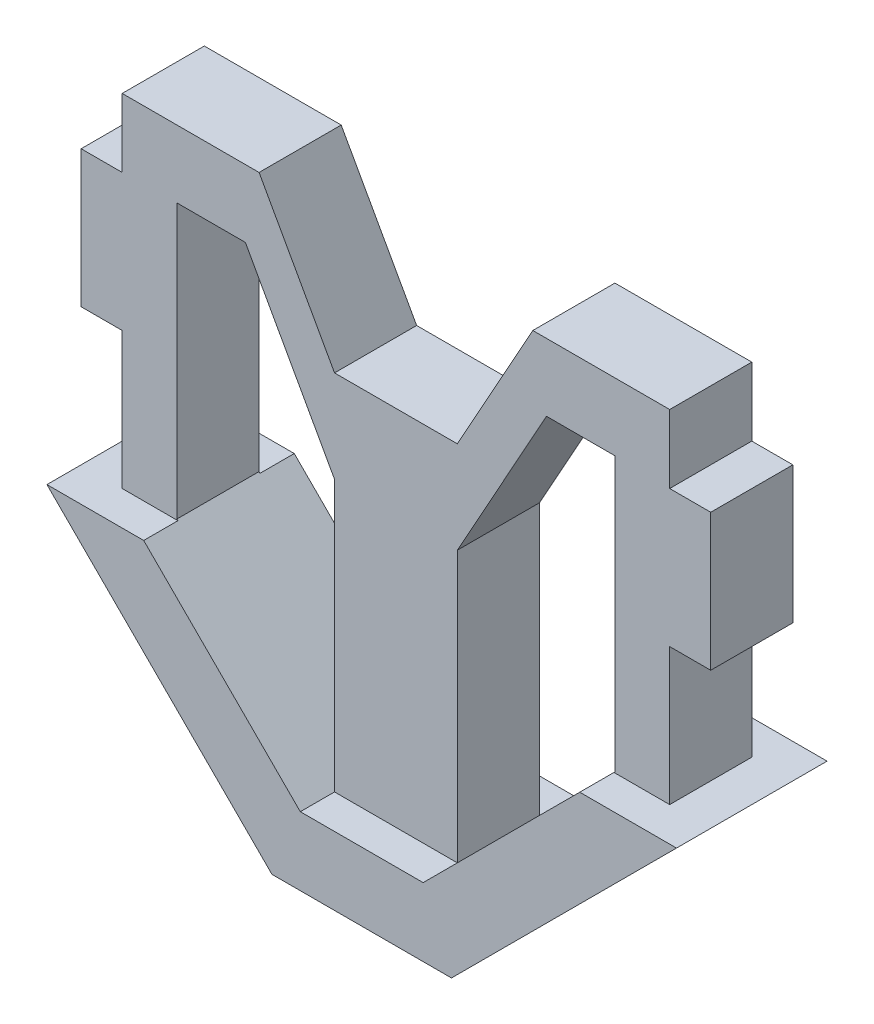
from build123d import *

# Parameters (mm, degrees)
BOSS_EXTRUDE1_DEPTH      = 6
BOSS_EXTRUDE2_DEPTH      = 2.5
BOSS_EXTRUDE2_DEPTH_BACK = 8.5


with BuildPart() as part:
    # Sketch1 → Boss-Extrude1 (new body)
    with BuildSketch(Plane.XY):
        Polygon((-20, -12.5), (-23, -12.5), (-6.55813284, -28.94186716), (6.55813284, -28.94186716), (23, -12.5), (20, -12.5), (20, -2.5), (23, -2.5), (23, 7.5), (20, 7.5), (20, 12.5), (10, 12.5), (4.487065029, 2.571710666), (-4.487065029, 2.571710666), (-10, 12.5), (-20, 12.5), (-20, 7.5), (-23, 7.5), (-23, -2.5), (-20, -2.5), align=None)
        Polygon((-16.000642854, -12.428289334), (-4.487065029, -23.94186716), (-4.487065029, -4.158644505), (-11.000642854, 7.571710666), (-16.000642854, 7.571710666), align=None, mode=Mode.SUBTRACT)
        Polygon((16.000642854, -12.428289334), (4.487065029, -23.94186716), (4.487065029, -4.158644505), (11.000642854, 7.571710666), (16.000642854, 7.571710666), align=None, mode=Mode.SUBTRACT)
    extrude(amount=BOSS_EXTRUDE1_DEPTH)

    # Sketch2 → Boss-Extrude2 (add, two sides: drawn at the far end of the back side and taken through both)
    with BuildSketch(Plane.XY.offset(6).offset(-BOSS_EXTRUDE2_DEPTH_BACK)):
        Polygon((-23, -12.5), (-6.55813284, -28.94186716), (6.55813284, -28.94186716), (23, -12.5), (15.928932188, -12.5), (10.243853941, -18.185078247), (4.487065029, -23.94186716), (-4.487065029, -23.94186716), (-10.243853941, -18.185078247), (-15.928932188, -12.5), align=None)
    extrude(amount=BOSS_EXTRUDE2_DEPTH + BOSS_EXTRUDE2_DEPTH_BACK)


solid = part.part
